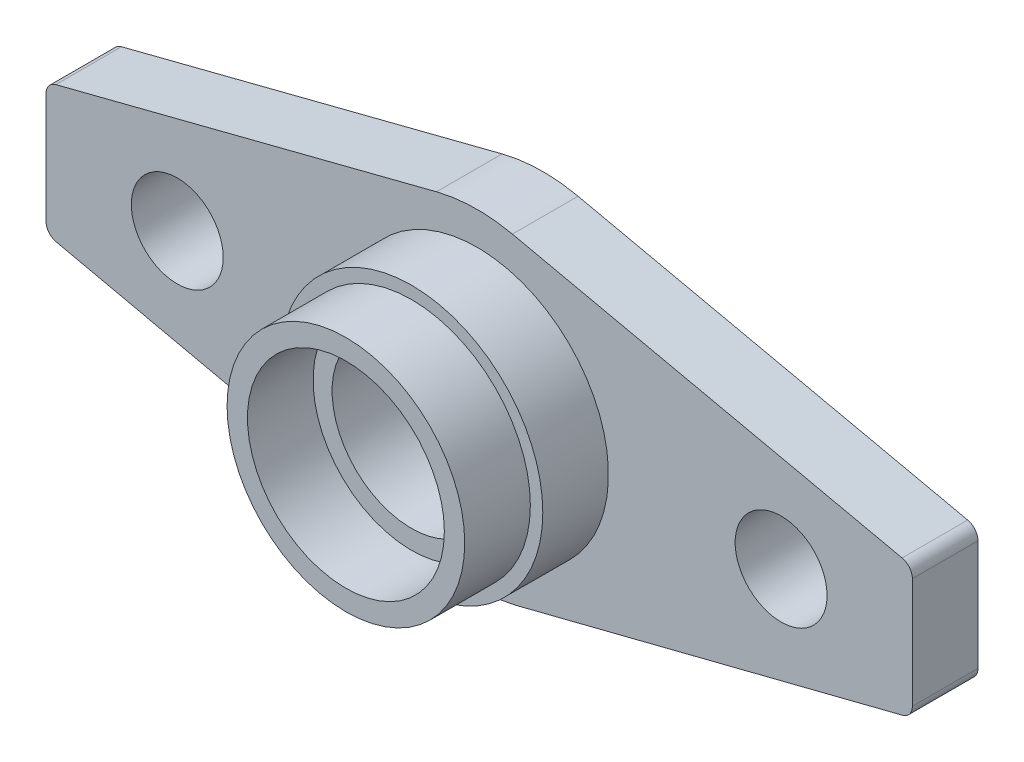
from build123d import *

# Parameters (mm, degrees)
SKETCH2_R           = 7.5
SKETCH2_R_2         = 3.5
BOSS_EXTRUDE1_DEPTH = 5
SKETCH3_R           = 10
SKETCH3_R_2         = 6.052399113
BOSS_EXTRUDE2_DEPTH = 5
SKETCH5_R           = 9.052399113
SKETCH5_R_2         = 7.5
BOSS_EXTRUDE3_DEPTH = 5


with BuildPart() as part:
    # Sketch2 → Boss-Extrude1 (new body)
    with BuildSketch(Plane.XY):
        with BuildLine():
            Line((-32.094512491, 4.68250523), (-3.101754703, 12.109051068))
            ThreePointArc((-3.101754703, 12.109051068), (-0.215678408, 12.498139174), (2.682104326, 12.208862207))
            Line((2.682104326, 12.208862207), (32.368196231, 5.687272056))
            ThreePointArc((32.368196231, 5.687272056), (32.932912283, 5.337233509), (33.153627885, 4.710563079))
            Line((33.153627885, 4.710563079), (33.153627885, -3.707266727))
            ThreePointArc((33.153627885, -3.707266727), (32.942891731, -4.321320943), (32.399502723, -4.676568312))
            Line((32.399502723, -4.676568312), (2.938551053, -12.149687967))
            ThreePointArc((2.938551053, -12.149687967), (0.047582142, -12.499909437), (-2.845969256, -12.171707316))
            Line((-2.845969256, -12.171707316), (-32.063143376, -5.684001735))
            ThreePointArc((-32.063143376, -5.684001735), (-32.626362904, -5.333570306), (-32.846372115, -4.707779311))
            Line((-32.846372115, -4.707779311), (-32.846372115, 3.713781144))
            ThreePointArc((-32.846372115, 3.713781144), (-32.636353246, 4.326912298), (-32.094512491, 4.68250523))
        make_face()
        Circle(SKETCH2_R, mode=Mode.SUBTRACT)
        with Locations((-22.846372115, -0.345688892)):
            Circle(SKETCH2_R_2, mode=Mode.SUBTRACT)
        with Locations((23.153627885, 0.350337985)):
            Circle(SKETCH2_R_2, mode=Mode.SUBTRACT)
    extrude(amount=BOSS_EXTRUDE1_DEPTH)

    # Sketch3 → Boss-Extrude2 (add)
    with BuildSketch(Plane.XY.offset(5)):
        with Locations(Location((0, 0, 0), (0, 0, 180))):
            Circle(SKETCH3_R)
        Circle(SKETCH3_R_2, mode=Mode.SUBTRACT)
    extrude(amount=BOSS_EXTRUDE2_DEPTH)

    # Sketch5 → Boss-Extrude3 (add)
    with BuildSketch(Plane.XY.offset(10)):
        Circle(SKETCH5_R)
        Circle(SKETCH5_R_2, mode=Mode.SUBTRACT)
    extrude(amount=BOSS_EXTRUDE3_DEPTH)


solid = part.part
